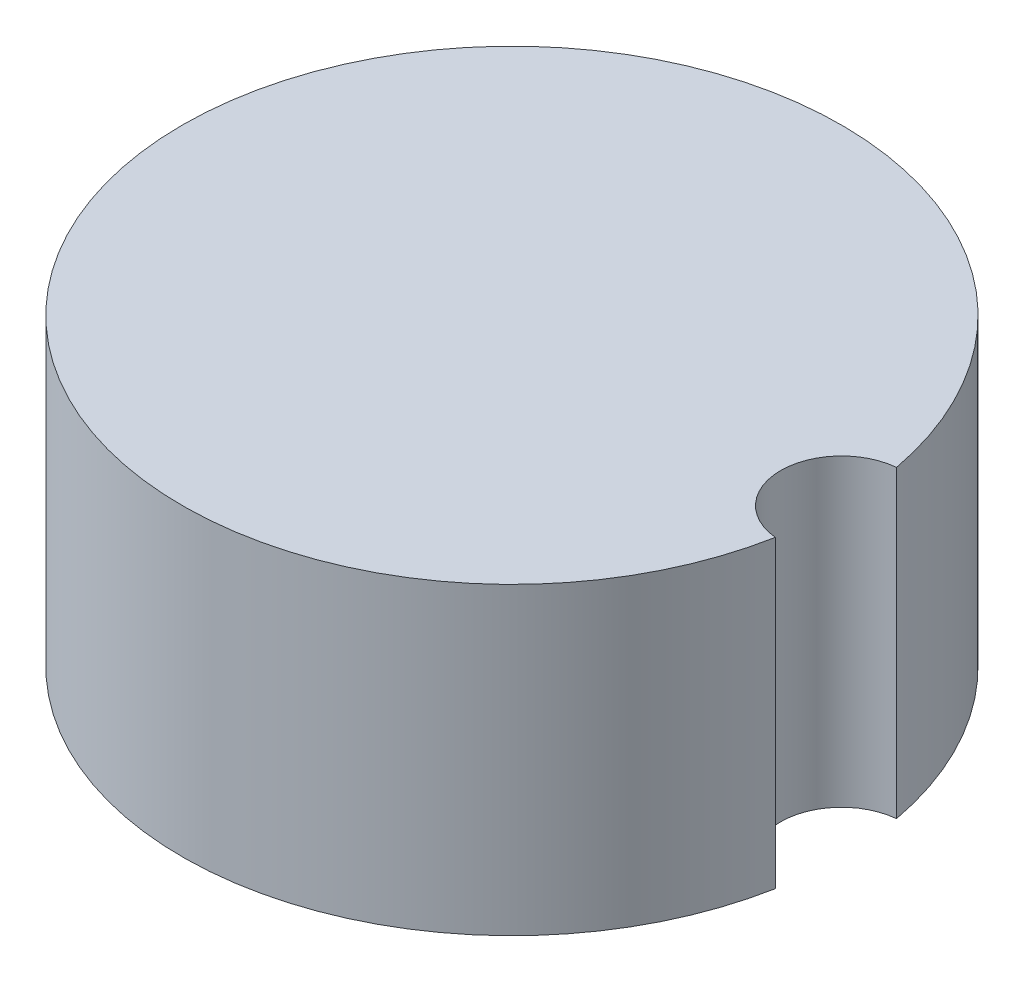
from build123d import *

# Parameters (mm, degrees)
BOSS_EXTRUDE1_DEPTH = 6


with BuildPart() as part:
    # Sketch1 → Boss-Extrude1 (new body)
    with BuildSketch(Plane(origin=(0, 75, 0), x_dir=(1, 0, 0), z_dir=(0, 1, 0))):
        with BuildLine():
            ThreePointArc((6.389230769, 1.194876637), (5.3, 0), (6.389230769, -1.194876637))
            ThreePointArc((6.389230769, -1.194876637), (-6.5, 0), (6.389230769, 1.194876637))
        make_face()
    extrude(amount=BOSS_EXTRUDE1_DEPTH)


solid = part.part
